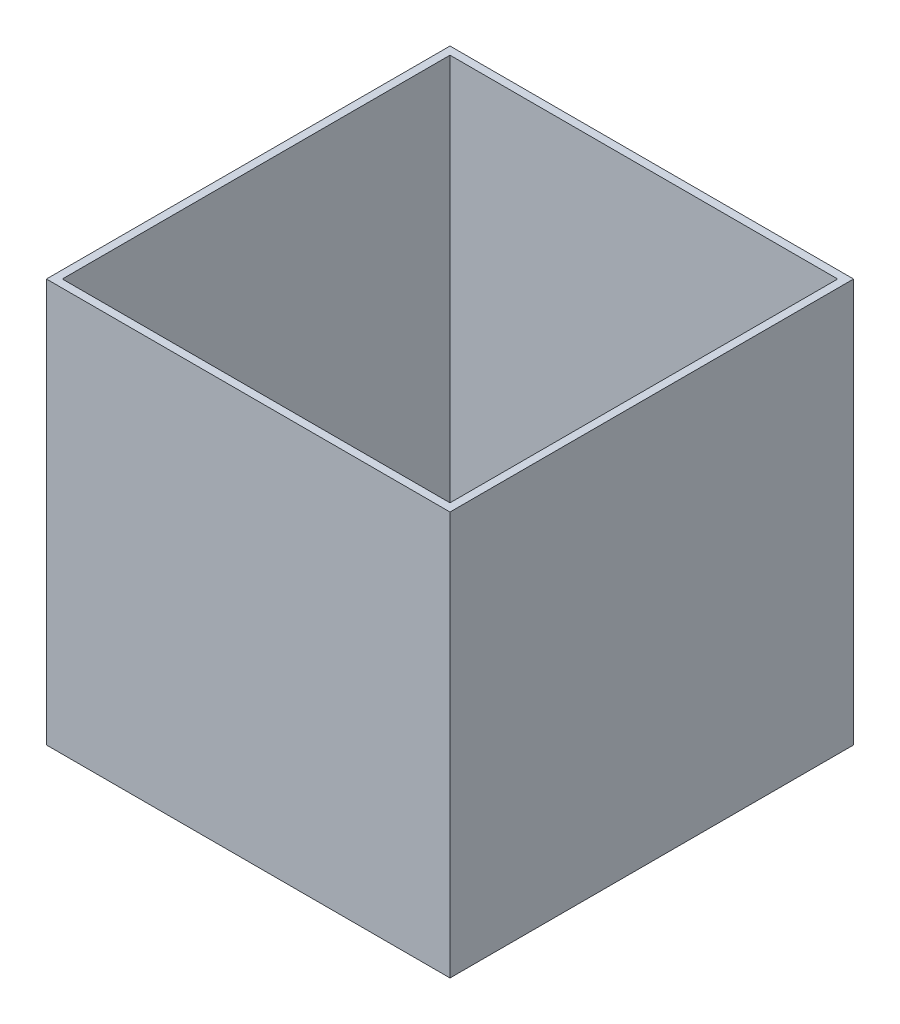
from build123d import *

# Parameters (mm, degrees)
SKETCH1_W           = 101.6
SKETCH1_H           = 101.6
BOSS_EXTRUDE1_DEPTH = 101.6
SKETCH2_W           = 97.6
SKETCH2_H           = 97.6
CUT_EXTRUDE1_DEPTH  = 99.6


with BuildPart() as part:
    # Sketch1 → Boss-Extrude1 (new body)
    with BuildSketch(Plane(origin=(0, 0, 0), x_dir=(1, 0, 0), z_dir=(0, 1, 0))):
        Rectangle(SKETCH1_W, SKETCH1_H)
    extrude(amount=BOSS_EXTRUDE1_DEPTH)

    # Sketch2 → Cut-Extrude1 (cut)
    with BuildSketch(Plane(origin=(0, 101.6, 0), x_dir=(1, 0, 0), z_dir=(0, 1, 0))):
        Rectangle(SKETCH2_W, SKETCH2_H)
    extrude(amount=-CUT_EXTRUDE1_DEPTH, mode=Mode.SUBTRACT)


solid = part.part
